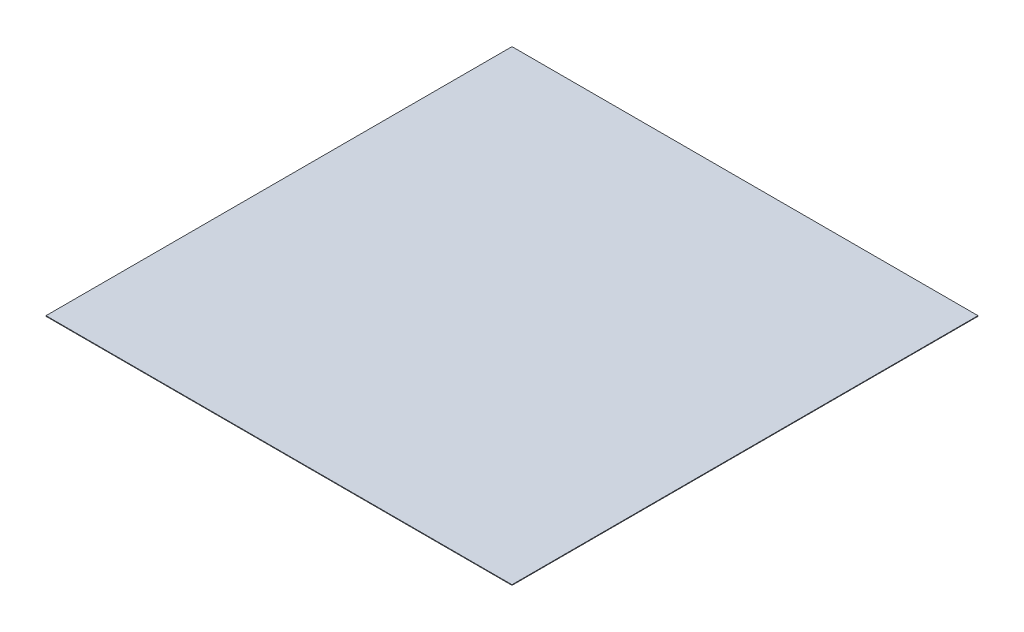
from build123d import *

# Parameters (mm, degrees)
SKETCH1_W           = 3310
SKETCH1_H           = 3310
BOSS_EXTRUDE1_DEPTH = 4.233333333


with BuildPart() as part:
    # Sketch1 → Boss-Extrude1 (new body)
    with BuildSketch(Plane(origin=(0, 0, 0), x_dir=(1, 0, 0), z_dir=(0, 1, 0))):
        with Locations((1655, -1655)):
            Rectangle(SKETCH1_W, SKETCH1_H)
    extrude(amount=BOSS_EXTRUDE1_DEPTH)


solid = part.part
